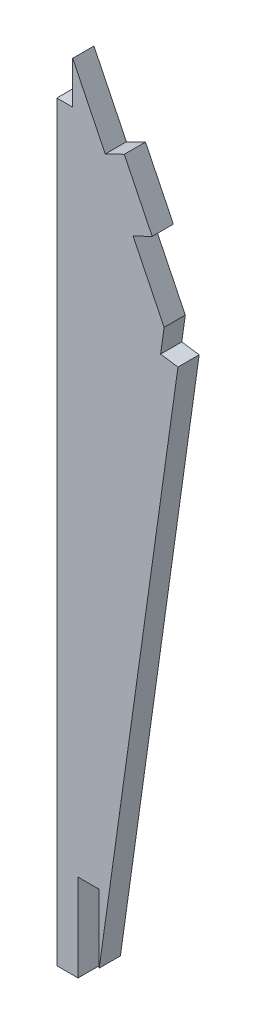
from build123d import *

# Parameters (mm, degrees)
EXTRUDE_1_DEPTH = 2


with BuildPart() as part:
    # 草图1 → 凸台-拉伸1 (new body)
    with BuildSketch(Plane.XY):
        Polygon((6.173056655, 80.743038467), (6.173056655, 76.743038467), (4.673056655, 76.743038467), (4.673056655, 5.835060062), (6.673056655, 5.835060062), (6.673056655, 14.085060062), (8.673056655, 14.085060062), (8.673056655, 7.640427596), (16.104503768, 60.476322438), (14.46295379, 60.707513556), (14.795028372, 63.065376733), (11.871881563, 69.058715865), (13.669469656, 69.935458159), (11.039242775, 75.328222437), (9.241654682, 74.451480143), align=None)
    extrude(amount=EXTRUDE_1_DEPTH)


solid = part.part
